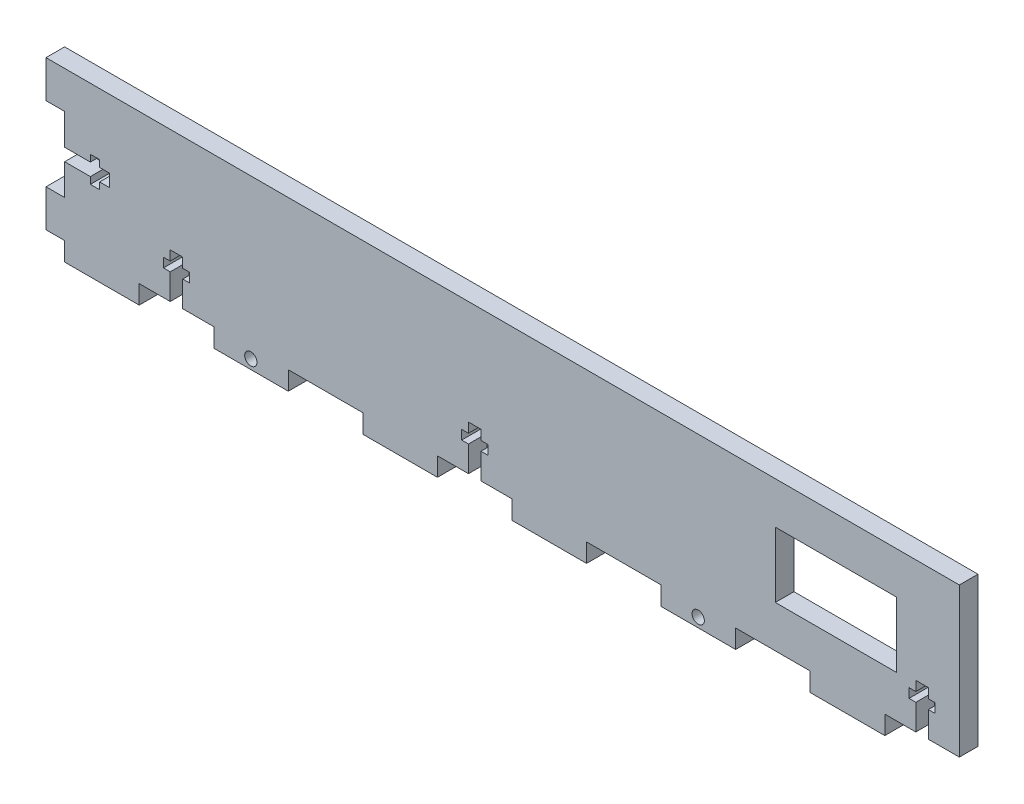
from build123d import *

# Parameters (mm, degrees)
SKETCH1_W           = 304.8
SKETCH1_H           = 50.8
BOSS_EXTRUDE1_DEPTH = 6.35
SKETCH2_W           = 41.275
SKETCH2_H           = 22.225
CUT_EXTRUDE1_DEPTH  = 265.034300402
SKETCH5_W           = 25.4
SKETCH5_H           = 6.35
BOSS_EXTRUDE2_DEPTH = 6.35
LPATTERN1_COUNT     = 6
LPATTERN1_PITCH     = 50.8
SKETCH6_W           = 6.35
SKETCH6_H           = 12.7
BOSS_EXTRUDE3_DEPTH = 6.35
LPATTERN2_COUNT     = 2
LPATTERN2_PITCH     = 38.1
CUT_EXTRUDE2_DEPTH  = 272.024068837
CUT_EXTRUDE3_DEPTH  = 272.024068837
SKETCH9_R           = 2.0955
CUT_EXTRUDE4_DEPTH  = 272.024068837


with BuildPart() as part:
    # Sketch1 → Boss-Extrude1 (new body)
    with BuildSketch(Plane.XY):
        with Locations((-110.333, 0)):
            Rectangle(SKETCH1_W, SKETCH1_H)
    extrude(amount=BOSS_EXTRUDE1_DEPTH)

    # Sketch2 → Cut-Extrude1 (cut, through all)
    with BuildSketch(Plane.XY.offset(6.35)):
        Rectangle(SKETCH2_W, SKETCH2_H)
    extrude(amount=-CUT_EXTRUDE1_DEPTH, mode=Mode.SUBTRACT)

    # Sketch5 → Boss-Extrude2 (add)
    with BuildSketch(Plane.XZ.offset(25.4)):
        with Locations((3.967, 3.175)):
            Rectangle(SKETCH5_W, SKETCH5_H)
    boss_extrude2 = extrude(amount=BOSS_EXTRUDE2_DEPTH)

    # LPattern1: Boss-Extrude2 ×6
    with Locations(*[(-i * LPATTERN1_PITCH, 0, 0) for i in range(1, LPATTERN1_COUNT)]):
        add(boss_extrude2)

    # Sketch6 → Boss-Extrude3 (add)
    with BuildSketch(Plane.ZY.offset(262.733)):
        with Locations((3.175, 19.05)):
            Rectangle(SKETCH6_W, SKETCH6_H)
    boss_extrude3 = extrude(amount=BOSS_EXTRUDE3_DEPTH)

    # LPattern2: Boss-Extrude3 ×2
    with Locations(*[(0, -i * LPATTERN2_PITCH, 0) for i in range(1, LPATTERN2_COUNT)]):
        add(boss_extrude3)

    # Sketch7 → Cut-Extrude2 (cut, through all)
    with BuildSketch(Plane.XY.offset(6.35)):
        Polygon((-262.733, 2.1336), (-262.733, -2.1336), (-253.97, -2.1336), (-253.97, -4.445), (-250.795, -4.445), (-250.795, -2.1336), (-247.493, -2.1336), (-247.493, 2.1336), (-250.795, 2.1336), (-250.795, 4.445), (-253.97, 4.445), (-253.97, 2.1336), align=None)
    extrude(amount=-CUT_EXTRUDE2_DEPTH, mode=Mode.SUBTRACT)

    # Sketch8 → Cut-Extrude3 (cut, through all)
    with BuildSketch(Plane.XY.offset(6.35)):
        Polygon((-226.7666, -25.4), (-222.4994, -25.4), (-222.4994, -16.637), (-220.188, -16.637), (-220.188, -13.462), (-222.4994, -13.462), (-222.4994, -10.16), (-226.7666, -10.16), (-226.7666, -13.462), (-229.078, -13.462), (-229.078, -16.637), (-226.7666, -16.637), align=None)
        Polygon((-125.1666, -25.4), (-120.8994, -25.4), (-120.8994, -16.637), (-118.588, -16.637), (-118.588, -13.462), (-120.8994, -13.462), (-120.8994, -10.16), (-125.1666, -10.16), (-125.1666, -13.462), (-127.478, -13.462), (-127.478, -16.637), (-125.1666, -16.637), align=None)
        Polygon((27.2334, -25.4), (31.5006, -25.4), (31.5006, -16.637), (33.812, -16.637), (33.812, -13.462), (31.5006, -13.462), (31.5006, -10.16), (27.2334, -10.16), (27.2334, -13.462), (24.922, -13.462), (24.922, -16.637), (27.2334, -16.637), align=None)
    extrude(amount=-CUT_EXTRUDE3_DEPTH, mode=Mode.SUBTRACT)

    # Sketch9 → Cut-Extrude4 (cut, through all)
    with BuildSketch(Plane(origin=(0, 0, 0), x_dir=(-1, 0, 0), z_dir=(0, 0, -1))):
        with Locations((46.904309807, -28.575)):
            Circle(SKETCH9_R)
        with Locations((199.304309807, -28.575)):
            Circle(SKETCH9_R)
    extrude(amount=-CUT_EXTRUDE4_DEPTH, mode=Mode.SUBTRACT)


solid = part.part
